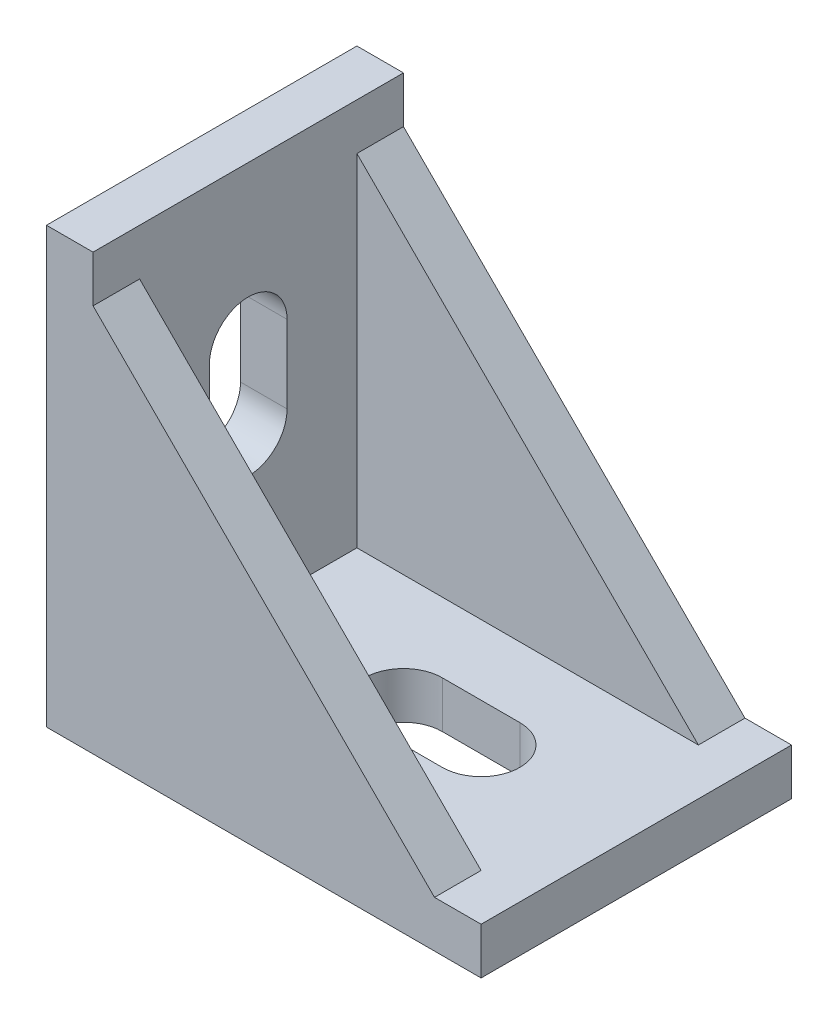
from build123d import *

# Parameters (mm, degrees)
BOSS_EXTRUDE1_DEPTH = 20
CUT_EXTRUDE1_DEPTH  = 14
CUT_EXTRUDE2_DEPTH  = 14
CUT_EXTRUDE3_DEPTH  = 14


with BuildPart() as part:
    # Sketch1 → Boss-Extrude1 (new body)
    with BuildSketch(Plane.XY):
        Polygon((0, 0), (0, 28), (3, 28), (3, 25), (25, 3), (28, 3), (28, 0), align=None)
    extrude(amount=-BOSS_EXTRUDE1_DEPTH)

    # Sketch2 → Cut-Extrude1 (cut)
    with BuildSketch(Plane.XY.offset(-3)):
        Polygon((3, 25), (3, 3), (25, 3), align=None)
    extrude(amount=-CUT_EXTRUDE1_DEPTH, mode=Mode.SUBTRACT)

    # Sketch3 → Cut-Extrude2 (cut)
    with BuildSketch(Plane(origin=(0, 3, 0), x_dir=(1, 0, 0), z_dir=(0, 1, 0))):
        with BuildLine():
            Line((18, 7.5), (13, 7.5))
            ThreePointArc((13, 7.5), (10.5, 10), (13, 12.5))
            Line((13, 12.5), (18, 12.5))
            ThreePointArc((18, 12.5), (20.5, 10), (18, 7.5))
        make_face()
    extrude(amount=-CUT_EXTRUDE2_DEPTH, mode=Mode.SUBTRACT)

    # Sketch4 → Cut-Extrude3 (cut)
    with BuildSketch(Plane(origin=(3, 0, 0), x_dir=(0, 0, -1), z_dir=(1, 0, 0))):
        with BuildLine():
            Line((7.5, 13), (7.5, 18))
            ThreePointArc((7.5, 18), (10, 20.5), (12.5, 18))
            Line((12.5, 18), (12.5, 13))
            ThreePointArc((12.5, 13), (10, 10.5), (7.5, 13))
        make_face()
    extrude(amount=-CUT_EXTRUDE3_DEPTH, mode=Mode.SUBTRACT)


solid = part.part
